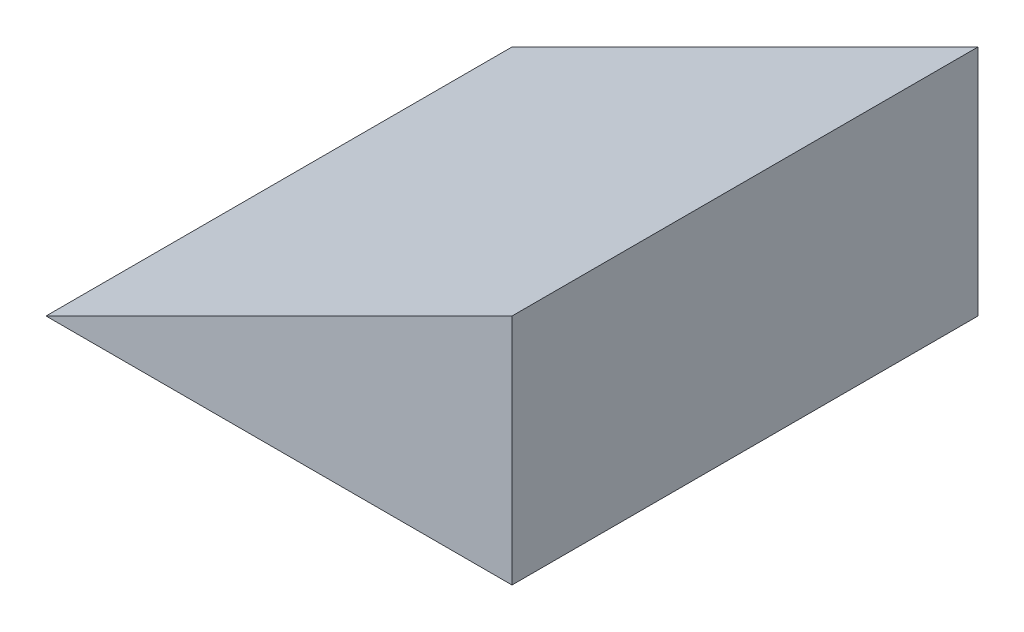
from build123d import *

# Parameters (mm, degrees)
DODANIE_WYCI_GNI_CIE1_DEPTH = 200


with BuildPart() as part:
    # Szkic1 → Dodanie-wyciągnięcie1 (new body)
    with BuildSketch(Plane.XY):
        Polygon((-62.64502772, -30.696202532), (137.35497228, -30.696202532), (137.35497228, 69.303797468), align=None)
    extrude(amount=DODANIE_WYCI_GNI_CIE1_DEPTH)


solid = part.part
